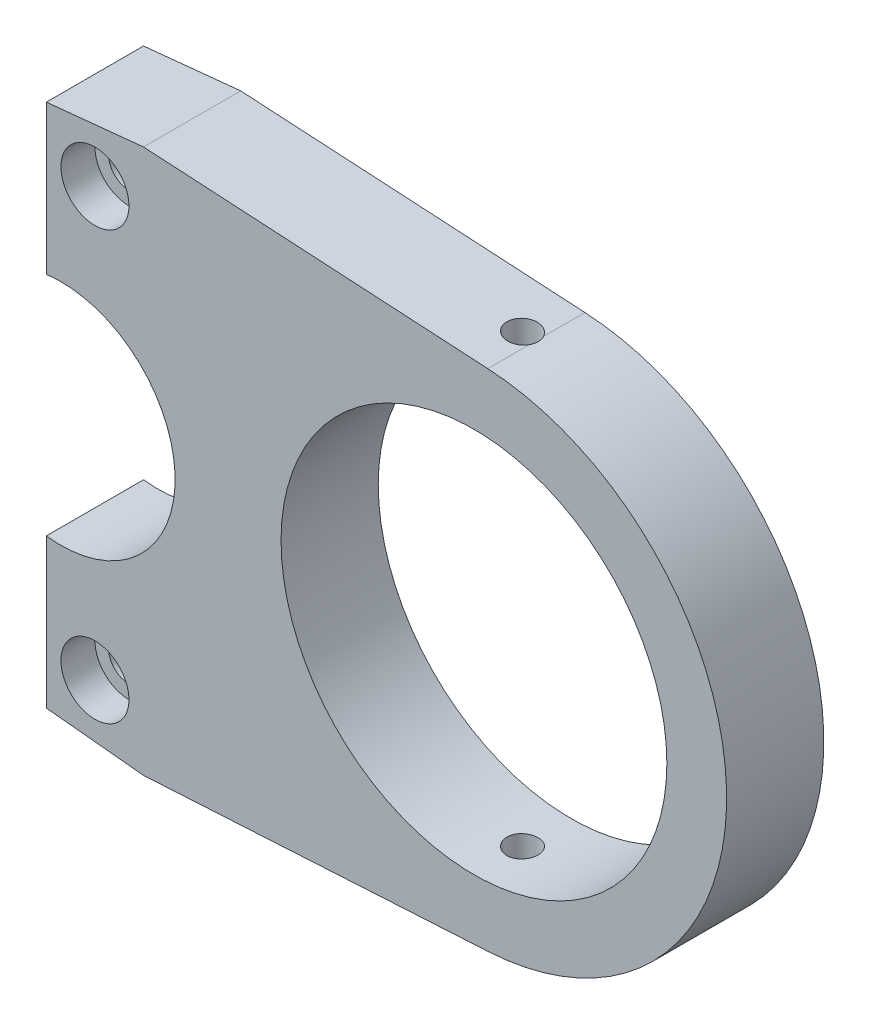
from build123d import *

# Parameters (mm, degrees)
SKETCH1_R           = 19.85
BOSS_EXTRUDE1_DEPTH = 10
SKETCH2_R           = 11.75
CUT_EXTRUDE1_DEPTH  = 10
SKETCH3_R           = 1.6
CUT_EXTRUDE2_DEPTH  = 27
SKETCH4_R           = 2.1
CUT_EXTRUDE3_DEPTH  = 10
SKETCH5_R           = 3.5
CUT_EXTRUDE4_DEPTH  = 3.5


with BuildPart() as part:
    # Sketch1 → Boss-Extrude1 (new body)
    with BuildSketch(Plane.XY):
        with BuildLine():
            Line((-34, 28), (1.418583132, 25.961381575))
            ThreePointArc((1.418583132, 25.961381575), (26.000109834, 0), (1.418583132, -25.961381575))
            Line((1.418583132, -25.961381575), (-34, -28))
            Line((-34, -28), (-44, -27))
            Line((-44, -27), (-44, 27))
            Line((-44, 27), (-34, 28))
        make_face()
        Circle(SKETCH1_R, mode=Mode.SUBTRACT)
    extrude(amount=BOSS_EXTRUDE1_DEPTH)

    # Sketch2 → Cut-Extrude1 (cut)
    with BuildSketch(Plane.XY.offset(10)):
        with Locations((-42.5, 0)):
            Circle(SKETCH2_R)
    extrude(amount=-CUT_EXTRUDE1_DEPTH, mode=Mode.SUBTRACT)

    # Sketch3 → Cut-Extrude2 (cut, symmetric)
    with BuildSketch(Plane(origin=(0, 0, 0), x_dir=(1, 0, 0), z_dir=(0, 1, 0))):
        with Locations(Location((0, -5, 0), (0, 0, 270))):
            Circle(SKETCH3_R)
    extrude(amount=CUT_EXTRUDE2_DEPTH, both=True, mode=Mode.SUBTRACT)

    # Sketch4 → Cut-Extrude3 (cut)
    with BuildSketch(Plane.XY.offset(10)):
        with Locations((-39, 22)):
            Circle(SKETCH4_R)
        with Locations((-39, -22)):
            Circle(SKETCH4_R)
    extrude(amount=-CUT_EXTRUDE3_DEPTH, mode=Mode.SUBTRACT)

    # Sketch5 → Cut-Extrude4 (cut)
    with BuildSketch(Plane.XY.offset(10)):
        with Locations((-39, 22)):
            Circle(SKETCH5_R)
        with Locations((-39, -22)):
            Circle(SKETCH5_R)
    extrude(amount=-CUT_EXTRUDE4_DEPTH, mode=Mode.SUBTRACT)


solid = part.part
